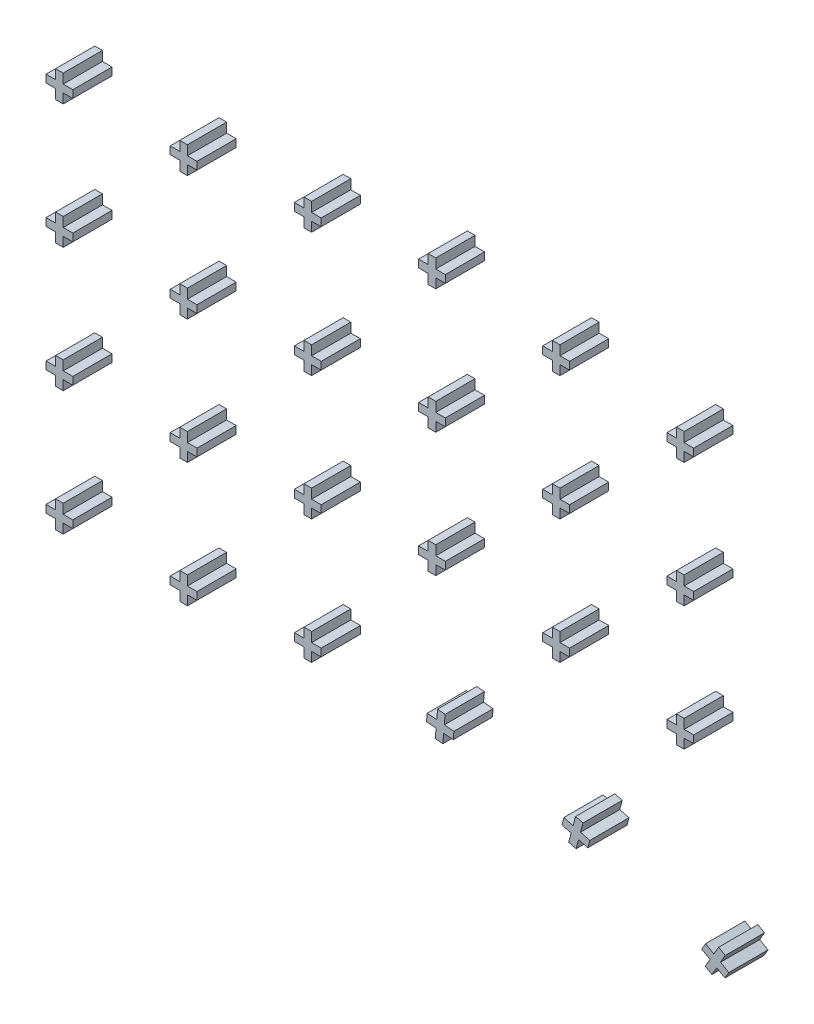
from build123d import *

# Parameters (mm, degrees)
BOSS_EXTRUDE1_DEPTH    = 6
BOSS_EXTRUDE1_2_DEPTH  = 6
BOSS_EXTRUDE1_3_DEPTH  = 6
BOSS_EXTRUDE1_4_DEPTH  = 6
BOSS_EXTRUDE1_5_DEPTH  = 6
BOSS_EXTRUDE1_6_DEPTH  = 6
BOSS_EXTRUDE1_7_DEPTH  = 6
BOSS_EXTRUDE1_8_DEPTH  = 6
BOSS_EXTRUDE1_9_DEPTH  = 6
BOSS_EXTRUDE1_10_DEPTH = 6
BOSS_EXTRUDE1_11_DEPTH = 6
BOSS_EXTRUDE1_12_DEPTH = 6
BOSS_EXTRUDE1_13_DEPTH = 6
BOSS_EXTRUDE1_14_DEPTH = 6
BOSS_EXTRUDE1_15_DEPTH = 6
BOSS_EXTRUDE1_16_DEPTH = 6
BOSS_EXTRUDE1_17_DEPTH = 6
BOSS_EXTRUDE1_18_DEPTH = 6
BOSS_EXTRUDE1_19_DEPTH = 6
BOSS_EXTRUDE1_20_DEPTH = 6
BOSS_EXTRUDE1_21_DEPTH = 6
BOSS_EXTRUDE1_22_DEPTH = 6
BOSS_EXTRUDE1_23_DEPTH = 6
BOSS_EXTRUDE1_24_DEPTH = 6


with BuildPart() as part:
    # Sketch3 → Boss-Extrude1 (new body)
    with BuildSketch(Plane.XY):
        Polygon((-53.936924117, 11.55), (-52.766924117, 11.55), (-52.766924117, 10.085), (-51.301924117, 10.085), (-51.301924117, 8.915), (-52.766924117, 8.915), (-52.766924117, 7.45), (-53.936924117, 7.45), (-53.936924117, 8.915), (-55.401924117, 8.915), (-55.401924117, 10.085), (-53.936924117, 10.085), align=None)
    extrude(amount=BOSS_EXTRUDE1_DEPTH)


with BuildPart() as body_2:
    # Sketch3 → Boss-Extrude1 2 (new body)
    with BuildSketch(Plane.XY):
        Polygon((4.505646755, -44.099934612), (5.671194552, -44.201906831), (5.543511389, -45.661332064), (7.002936622, -45.789015227), (6.900964403, -46.954563024), (5.44153917, -46.82687986), (5.313856007, -48.286305093), (4.14830821, -48.184332874), (4.275991373, -46.724907641), (2.81656614, -46.597224478), (2.918538359, -45.431676682), (4.377963592, -45.559359845), align=None)
    extrude(amount=BOSS_EXTRUDE1_2_DEPTH)


with BuildPart() as body_3:
    # Sketch3 → Boss-Extrude1 3 (new body)
    with BuildSketch(Plane.XY):
        Polygon((-34.936924117, 11.55), (-33.766924117, 11.55), (-33.766924117, 10.085), (-32.301924117, 10.085), (-32.301924117, 8.915), (-33.766924117, 8.915), (-33.766924117, 7.45), (-34.936924117, 7.45), (-34.936924117, 8.915), (-36.401924117, 8.915), (-36.401924117, 10.085), (-34.936924117, 10.085), align=None)
    extrude(amount=BOSS_EXTRUDE1_3_DEPTH)


with BuildPart() as body_4:
    # Sketch3 → Boss-Extrude1 4 (new body)
    with BuildSketch(Plane.XY):
        Polygon((-15.936924117, 13.55), (-14.766924117, 13.55), (-14.766924117, 12.085), (-13.301924117, 12.085), (-13.301924117, 10.915), (-14.766924117, 10.915), (-14.766924117, 9.45), (-15.936924117, 9.45), (-15.936924117, 10.915), (-17.401924117, 10.915), (-17.401924117, 12.085), (-15.936924117, 12.085), align=None)
    extrude(amount=BOSS_EXTRUDE1_4_DEPTH)


with BuildPart() as body_5:
    # Sketch3 → Boss-Extrude1 5 (new body)
    with BuildSketch(Plane.XY):
        Polygon((3.063075883, 15.55), (4.233075883, 15.55), (4.233075883, 14.085), (5.698075883, 14.085), (5.698075883, 12.915), (4.233075883, 12.915), (4.233075883, 11.45), (3.063075883, 11.45), (3.063075883, 12.915), (1.598075883, 12.915), (1.598075883, 14.085), (3.063075883, 14.085), align=None)
    extrude(amount=BOSS_EXTRUDE1_5_DEPTH)


with BuildPart() as body_6:
    # Sketch3 → Boss-Extrude1 6 (new body)
    with BuildSketch(Plane.XY):
        Polygon((22.063075883, 13.55), (23.233075883, 13.55), (23.233075883, 12.085), (24.698075883, 12.085), (24.698075883, 10.915), (23.233075883, 10.915), (23.233075883, 9.45), (22.063075883, 9.45), (22.063075883, 10.915), (20.598075883, 10.915), (20.598075883, 12.085), (22.063075883, 12.085), align=None)
    extrude(amount=BOSS_EXTRUDE1_6_DEPTH)


with BuildPart() as body_7:
    # Sketch3 → Boss-Extrude1 7 (new body)
    with BuildSketch(Plane.XY):
        Polygon((22.063075883, -5.45), (23.233075883, -5.45), (23.233075883, -6.915), (24.698075883, -6.915), (24.698075883, -8.085), (23.233075883, -8.085), (23.233075883, -9.55), (22.063075883, -9.55), (22.063075883, -8.085), (20.598075883, -8.085), (20.598075883, -6.915), (22.063075883, -6.915), align=None)
    extrude(amount=BOSS_EXTRUDE1_7_DEPTH)


with BuildPart() as body_8:
    # Sketch3 → Boss-Extrude1 8 (new body)
    with BuildSketch(Plane.XY):
        Polygon((3.063075883, -3.45), (4.233075883, -3.45), (4.233075883, -4.915), (5.698075883, -4.915), (5.698075883, -6.085), (4.233075883, -6.085), (4.233075883, -7.55), (3.063075883, -7.55), (3.063075883, -6.085), (1.598075883, -6.085), (1.598075883, -4.915), (3.063075883, -4.915), align=None)
    extrude(amount=BOSS_EXTRUDE1_8_DEPTH)


with BuildPart() as body_9:
    # Sketch3 → Boss-Extrude1 9 (new body)
    with BuildSketch(Plane.XY):
        Polygon((-15.936924117, -5.45), (-14.766924117, -5.45), (-14.766924117, -6.915), (-13.301924117, -6.915), (-13.301924117, -8.085), (-14.766924117, -8.085), (-14.766924117, -9.55), (-15.936924117, -9.55), (-15.936924117, -8.085), (-17.401924117, -8.085), (-17.401924117, -6.915), (-15.936924117, -6.915), align=None)
    extrude(amount=BOSS_EXTRUDE1_9_DEPTH)


with BuildPart() as body_10:
    # Sketch3 → Boss-Extrude1 10 (new body)
    with BuildSketch(Plane.XY):
        Polygon((3.063075883, -22.45), (4.233075883, -22.45), (4.233075883, -23.915), (5.698075883, -23.915), (5.698075883, -25.085), (4.233075883, -25.085), (4.233075883, -26.55), (3.063075883, -26.55), (3.063075883, -25.085), (1.598075883, -25.085), (1.598075883, -23.915), (3.063075883, -23.915), align=None)
    extrude(amount=BOSS_EXTRUDE1_10_DEPTH)


with BuildPart() as body_11:
    # Sketch3 → Boss-Extrude1 11 (new body)
    with BuildSketch(Plane.XY):
        Polygon((-15.936924117, -24.45), (-14.766924117, -24.45), (-14.766924117, -25.915), (-13.301924117, -25.915), (-13.301924117, -27.085), (-14.766924117, -27.085), (-14.766924117, -28.55), (-15.936924117, -28.55), (-15.936924117, -27.085), (-17.401924117, -27.085), (-17.401924117, -25.915), (-15.936924117, -25.915), align=None)
    extrude(amount=BOSS_EXTRUDE1_11_DEPTH)


with BuildPart() as body_12:
    # Sketch3 → Boss-Extrude1 12 (new body)
    with BuildSketch(Plane.XY):
        Polygon((-34.936924117, -7.45), (-33.766924117, -7.45), (-33.766924117, -8.915), (-32.301924117, -8.915), (-32.301924117, -10.085), (-33.766924117, -10.085), (-33.766924117, -11.55), (-34.936924117, -11.55), (-34.936924117, -10.085), (-36.401924117, -10.085), (-36.401924117, -8.915), (-34.936924117, -8.915), align=None)
    extrude(amount=BOSS_EXTRUDE1_12_DEPTH)


with BuildPart() as body_13:
    # Sketch3 → Boss-Extrude1 13 (new body)
    with BuildSketch(Plane.XY):
        Polygon((-53.936924117, -7.45), (-52.766924117, -7.45), (-52.766924117, -8.915), (-51.301924117, -8.915), (-51.301924117, -10.085), (-52.766924117, -10.085), (-52.766924117, -11.55), (-53.936924117, -11.55), (-53.936924117, -10.085), (-55.401924117, -10.085), (-55.401924117, -8.915), (-53.936924117, -8.915), align=None)
    extrude(amount=BOSS_EXTRUDE1_13_DEPTH)


with BuildPart() as body_14:
    # Sketch3 → Boss-Extrude1 14 (new body)
    with BuildSketch(Plane.XY):
        Polygon((-53.936924117, -26.45), (-52.766924117, -26.45), (-52.766924117, -27.915), (-51.301924117, -27.915), (-51.301924117, -29.085), (-52.766924117, -29.085), (-52.766924117, -30.55), (-53.936924117, -30.55), (-53.936924117, -29.085), (-55.401924117, -29.085), (-55.401924117, -27.915), (-53.936924117, -27.915), align=None)
    extrude(amount=BOSS_EXTRUDE1_14_DEPTH)


with BuildPart() as body_15:
    # Sketch3 → Boss-Extrude1 15 (new body)
    with BuildSketch(Plane.XY):
        Polygon((-34.936924117, -26.45), (-33.766924117, -26.45), (-33.766924117, -27.915), (-32.301924117, -27.915), (-32.301924117, -29.085), (-33.766924117, -29.085), (-33.766924117, -30.55), (-34.936924117, -30.55), (-34.936924117, -29.085), (-36.401924117, -29.085), (-36.401924117, -27.915), (-34.936924117, -27.915), align=None)
    extrude(amount=BOSS_EXTRUDE1_15_DEPTH)


with BuildPart() as body_16:
    # Sketch3 → Boss-Extrude1 16 (new body)
    with BuildSketch(Plane.XY):
        Polygon((-53.936924117, -45.45), (-52.766924117, -45.45), (-52.766924117, -46.915), (-51.301924117, -46.915), (-51.301924117, -48.085), (-52.766924117, -48.085), (-52.766924117, -49.55), (-53.936924117, -49.55), (-53.936924117, -48.085), (-55.401924117, -48.085), (-55.401924117, -46.915), (-53.936924117, -46.915), align=None)
    extrude(amount=BOSS_EXTRUDE1_16_DEPTH)


with BuildPart() as body_17:
    # Sketch3 → Boss-Extrude1 17 (new body)
    with BuildSketch(Plane.XY):
        Polygon((-34.936924117, -45.45), (-33.766924117, -45.45), (-33.766924117, -46.915), (-32.301924117, -46.915), (-32.301924117, -48.085), (-33.766924117, -48.085), (-33.766924117, -49.55), (-34.936924117, -49.55), (-34.936924117, -48.085), (-36.401924117, -48.085), (-36.401924117, -46.915), (-34.936924117, -46.915), align=None)
    extrude(amount=BOSS_EXTRUDE1_17_DEPTH)


with BuildPart() as body_18:
    # Sketch3 → Boss-Extrude1 18 (new body)
    with BuildSketch(Plane.XY):
        Polygon((-15.936924117, -43.45), (-14.766924117, -43.45), (-14.766924117, -44.915), (-13.301924117, -44.915), (-13.301924117, -46.085), (-14.766924117, -46.085), (-14.766924117, -47.55), (-15.936924117, -47.55), (-15.936924117, -46.085), (-17.401924117, -46.085), (-17.401924117, -44.915), (-15.936924117, -44.915), align=None)
    extrude(amount=BOSS_EXTRUDE1_18_DEPTH)


with BuildPart() as body_19:
    # Sketch3 → Boss-Extrude1 19 (new body)
    with BuildSketch(Plane.XY):
        Polygon((25.632766719, -47.751041435), (26.762899935, -48.053859718), (26.383730034, -49.468941054), (27.79881137, -49.848110955), (27.495993087, -50.978244171), (26.080911751, -50.59907427), (25.70174185, -52.014155606), (24.571608634, -51.711337323), (24.950778535, -50.296255988), (23.535697199, -49.917086087), (23.838515482, -48.78695287), (25.253596817, -49.166122771), align=None)
    extrude(amount=BOSS_EXTRUDE1_19_DEPTH)


with BuildPart() as body_20:
    # Sketch3 → Boss-Extrude1 20 (new body)
    with BuildSketch(Plane.XY):
        Polygon((22.063075883, -24.45), (23.233075883, -24.45), (23.233075883, -25.915), (24.698075883, -25.915), (24.698075883, -27.085), (23.233075883, -27.085), (23.233075883, -28.55), (22.063075883, -28.55), (22.063075883, -27.085), (20.598075883, -27.085), (20.598075883, -25.915), (22.063075883, -25.915), align=None)
    extrude(amount=BOSS_EXTRUDE1_20_DEPTH)


with BuildPart() as body_21:
    # Sketch3 → Boss-Extrude1 21 (new body)
    with BuildSketch(Plane.XY):
        Polygon((41.063075883, -7.45), (42.233075883, -7.45), (42.233075883, -8.915), (43.698075883, -8.915), (43.698075883, -10.085), (42.233075883, -10.085), (42.233075883, -11.55), (41.063075883, -11.55), (41.063075883, -10.085), (39.598075883, -10.085), (39.598075883, -8.915), (41.063075883, -8.915), align=None)
    extrude(amount=BOSS_EXTRUDE1_21_DEPTH)


with BuildPart() as body_22:
    # Sketch3 → Boss-Extrude1 22 (new body)
    with BuildSketch(Plane.XY):
        Polygon((41.063075883, 11.55), (42.233075883, 11.55), (42.233075883, 10.085), (43.698075883, 10.085), (43.698075883, 8.915), (42.233075883, 8.915), (42.233075883, 7.45), (41.063075883, 7.45), (41.063075883, 8.915), (39.598075883, 8.915), (39.598075883, 10.085), (41.063075883, 10.085), align=None)
    extrude(amount=BOSS_EXTRUDE1_22_DEPTH)


with BuildPart() as body_23:
    # Sketch3 → Boss-Extrude1 23 (new body)
    with BuildSketch(Plane.XY):
        Polygon((41.063075883, -26.45), (42.233075883, -26.45), (42.233075883, -27.915), (43.698075883, -27.915), (43.698075883, -29.085), (42.233075883, -29.085), (42.233075883, -30.55), (41.063075883, -30.55), (41.063075883, -29.085), (39.598075883, -29.085), (39.598075883, -27.915), (41.063075883, -27.915), align=None)
    extrude(amount=BOSS_EXTRUDE1_23_DEPTH)


with BuildPart() as body_24:
    # Sketch3 → Boss-Extrude1 24 (new body)
    with BuildSketch(Plane.XY):
        Polygon((47.51608401, -54.137396432), (48.529333732, -54.722396432), (47.796833732, -55.991123649), (49.065560949, -56.723623649), (48.480560949, -57.736873371), (47.211833732, -57.004373371), (46.479333732, -58.273100588), (45.46608401, -57.688100588), (46.19858401, -56.419373371), (44.929856793, -55.686873371), (45.514856793, -54.673623649), (46.78358401, -55.406123649), align=None)
    extrude(amount=BOSS_EXTRUDE1_24_DEPTH)


solid = Compound([part.part, body_2.part, body_3.part, body_4.part, body_5.part, body_6.part, body_7.part, body_8.part, body_9.part, body_10.part, body_11.part, body_12.part, body_13.part, body_14.part, body_15.part, body_16.part, body_17.part, body_18.part, body_19.part, body_20.part, body_21.part, body_22.part, body_23.part, body_24.part])
